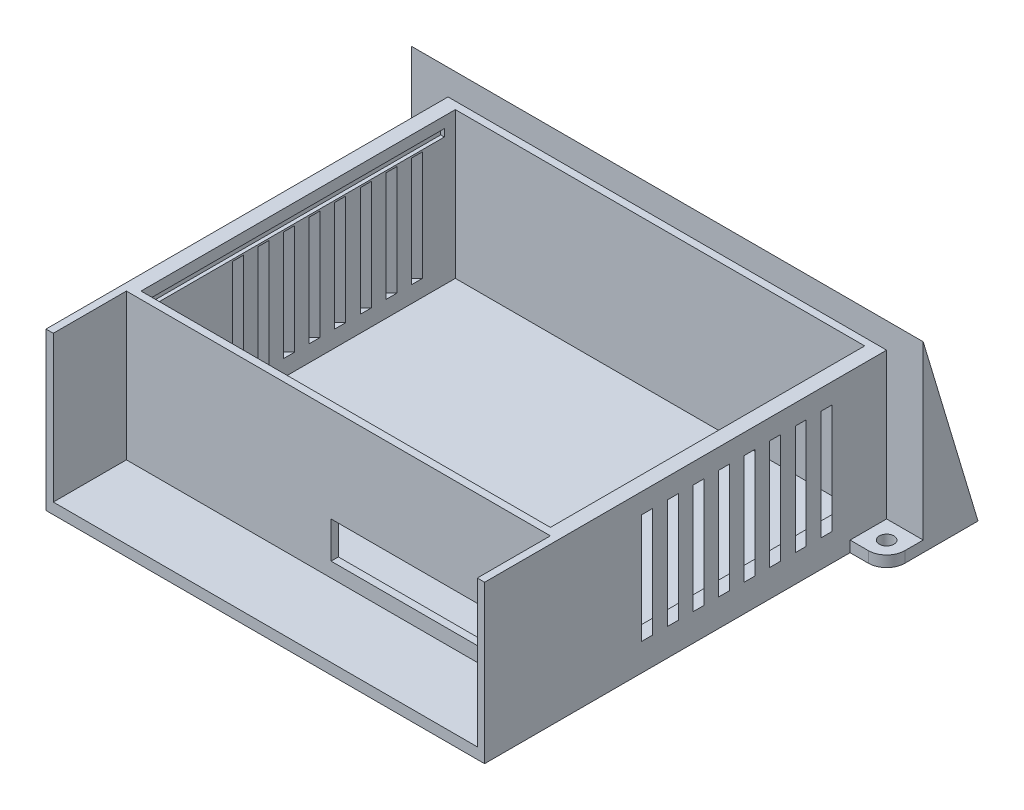
from build123d import *

# Parameters (mm, degrees)
SKETCH1_W                       = 120
SKETCH1_H                       = 110
BOSS_EXTRUDE1_DEPTH             = 3
SKETCH2_W                       = 112
SKETCH2_H                       = 86
BOSS_EXTRUDE2_DEPTH             = 40
BOSS_EXTRUDE3_DEPTH             = 10
BOSS_EXTRUDE3_DEPTH_BACK        = 130
SKIZZE2_R                       = 2
AUFSATZ_LINEAR_AUSTRAGEN1_DEPTH = 3
SKIZZE3_W                       = 3
SKIZZE3_H                       = 30
SCHNITT_LINEAR_AUSTRAGEN1_DEPTH = 13
SKIZZE8_W                       = 3
SKIZZE8_H                       = 30
SCHNITT_LINEAR_AUSTRAGEN2_DEPTH = 13
SKIZZE10_W                      = 80
SKIZZE10_H                      = 2
SCHNITT_LINEAR_AUSTRAGEN3_DEPTH = 1
SKIZZE11_W                      = 80
SKIZZE11_H                      = 2
SCHNITT_LINEAR_AUSTRAGEN4_DEPTH = 1
SKIZZE12_W                      = 55
SKIZZE12_H                      = 10
SCHNITT_LINEAR_AUSTRAGEN5_DEPTH = 31


with BuildPart() as part:
    # Sketch1 → Boss-Extrude1 (new body)
    with BuildSketch(Plane(origin=(0, 0, 0), x_dir=(1, 0, 0), z_dir=(0, 1, 0))):
        with Locations((22.161290323, 12.956989247)):
            Rectangle(SKETCH1_W, SKETCH1_H)
    extrude(amount=BOSS_EXTRUDE1_DEPTH)

    # Sketch2 → Boss-Extrude2 (add)
    with BuildSketch(Plane(origin=(0, 3, 0), x_dir=(1, 0, 0), z_dir=(0, 1, 0))):
        Polygon((-37.838709677, 67.956989247), (-37.838709677, -42.043010753), (-35.838709677, -42.043010753), (-35.838709677, -22.043010753), (80.161290323, -22.043010753), (80.161290323, -42.043010753), (82.161290323, -42.043010753), (82.161290323, 67.956989247), align=None)
        with Locations((22.161290323, 22.956989247)):
            Rectangle(SKETCH2_W, SKETCH2_H, mode=Mode.SUBTRACT)
    extrude(amount=BOSS_EXTRUDE2_DEPTH)

    # Sketch3 → Boss-Extrude3 (add, two sides: drawn at the far end of the back side and taken through both)
    with BuildSketch(Plane(origin=(82.161290323, 0, 0), x_dir=(0, 0, -1), z_dir=(1, 0, 0)).offset(-BOSS_EXTRUDE3_DEPTH_BACK)):
        Polygon((67.956989247, 50), (82.956989247, 0), (67.956989247, 0), align=None)
    extrude(amount=BOSS_EXTRUDE3_DEPTH + BOSS_EXTRUDE3_DEPTH_BACK)

    # Skizze2 → Aufsatz-Linear austragen1 (add)
    # profile 1 of 2: a face of its own
    with BuildSketch(Plane.XZ):
        with BuildLine():
            Line((82.161290323, -67.956989247), (92.161290323, -67.956989247))
            Line((92.161290323, -67.956989247), (92.161290323, -62.956989247))
            ThreePointArc((92.161290323, -62.956989247), (90.696824229, -59.421455341), (87.161290323, -57.956989247))
            Line((87.161290323, -57.956989247), (82.161290323, -57.956989247))
            Line((82.161290323, -57.956989247), (82.161290323, -67.956989247))
        make_face()
        with Locations(Location((87.161290323, -62.956989247, 0), (0, 0, 270))):
            Circle(SKIZZE2_R, mode=Mode.SUBTRACT)
    # profile 2 of 2: a face of its own
    with BuildSketch(Plane.XZ):
        with BuildLine():
            Line((-37.838709677, -67.956989247), (-47.838709677, -67.956989247))
            Line((-47.838709677, -67.956989247), (-47.838709677, -62.956989247))
            ThreePointArc((-47.838709677, -62.956989247), (-46.374243583, -59.421455341), (-42.838709677, -57.956989247))
            Line((-42.838709677, -57.956989247), (-37.838709677, -57.956989247))
            Line((-37.838709677, -57.956989247), (-37.838709677, -67.956989247))
        make_face()
        with Locations(Location((-42.838709677, -62.956989247, 0), (0, 0, 270))):
            Circle(SKIZZE2_R, mode=Mode.SUBTRACT)
    extrude(amount=-AUFSATZ_LINEAR_AUSTRAGEN1_DEPTH)

    # Skizze3 → Schnitt-Linear austragen1 (cut, along a direction that is not the sketch's normal)
    with BuildSketch(Plane(origin=(82.161290323, 0, 0), x_dir=(0, 0, -1), z_dir=(1, 0, 0))):
        with Locations((51.456989247, 22.5)):
            Rectangle(SKIZZE3_W, SKIZZE3_H)
        with Locations((44.456989247, 22.5)):
            Rectangle(SKIZZE3_W, SKIZZE3_H)
        with Locations((37.456989247, 22.5)):
            Rectangle(SKIZZE3_W, SKIZZE3_H)
        with Locations((30.456989247, 22.5)):
            Rectangle(SKIZZE3_W, SKIZZE3_H)
        with Locations((23.456989247, 22.5)):
            Rectangle(SKIZZE3_W, SKIZZE3_H)
        with Locations((16.456989247, 22.5)):
            Rectangle(SKIZZE3_W, SKIZZE3_H)
        with Locations((9.456989247, 22.5)):
            Rectangle(SKIZZE3_W, SKIZZE3_H)
        with Locations((2.456989247, 22.5)):
            Rectangle(SKIZZE3_W, SKIZZE3_H)
    extrude(amount=-SCHNITT_LINEAR_AUSTRAGEN1_DEPTH, dir=(0.7071067811865519, 0, 0.7071067811865432), mode=Mode.SUBTRACT)

    # Skizze8 → Schnitt-Linear austragen2 (cut, along a direction that is not the sketch's normal)
    with BuildSketch(Plane.ZY.offset(37.838709677)):
        with Locations((-51.456989247, 22.5)):
            Rectangle(SKIZZE8_W, SKIZZE8_H)
        with Locations((-44.456989247, 22.5)):
            Rectangle(SKIZZE8_W, SKIZZE8_H)
        with Locations((-37.456989247, 22.5)):
            Rectangle(SKIZZE8_W, SKIZZE8_H)
        with Locations((-30.456989247, 22.5)):
            Rectangle(SKIZZE8_W, SKIZZE8_H)
        with Locations((-23.456989247, 22.5)):
            Rectangle(SKIZZE8_W, SKIZZE8_H)
        with Locations((-16.456989247, 22.5)):
            Rectangle(SKIZZE8_W, SKIZZE8_H)
        with Locations((-9.456989247, 22.5)):
            Rectangle(SKIZZE8_W, SKIZZE8_H)
        with Locations((-2.456989247, 22.5)):
            Rectangle(SKIZZE8_W, SKIZZE8_H)
    extrude(amount=-SCHNITT_LINEAR_AUSTRAGEN2_DEPTH, dir=(-0.7071067811865462, 0, 0.7071067811865488), mode=Mode.SUBTRACT)

    # Skizze10 → Schnitt-Linear austragen3 (cut)
    with BuildSketch(Plane(origin=(-33.838709677, 0, 0), x_dir=(0, 0, -1), z_dir=(1, 0, 0))):
        with Locations((22.956989247, 39)):
            Rectangle(SKIZZE10_W, SKIZZE10_H)
    extrude(amount=-SCHNITT_LINEAR_AUSTRAGEN3_DEPTH, mode=Mode.SUBTRACT)

    # Skizze11 → Schnitt-Linear austragen4 (cut)
    with BuildSketch(Plane.ZY.offset(-78.161290323)):
        with Locations((-22.956989247, 39)):
            Rectangle(SKIZZE11_W, SKIZZE11_H)
    extrude(amount=-SCHNITT_LINEAR_AUSTRAGEN4_DEPTH, mode=Mode.SUBTRACT)

    # Skizze12 → Schnitt-Linear austragen5 (cut)
    with BuildSketch(Plane.XY.offset(22.043010753)):
        with Locations((47.661290323, 12)):
            Rectangle(SKIZZE12_W, SKIZZE12_H)
    extrude(amount=-SCHNITT_LINEAR_AUSTRAGEN5_DEPTH, mode=Mode.SUBTRACT)


solid = part.part
